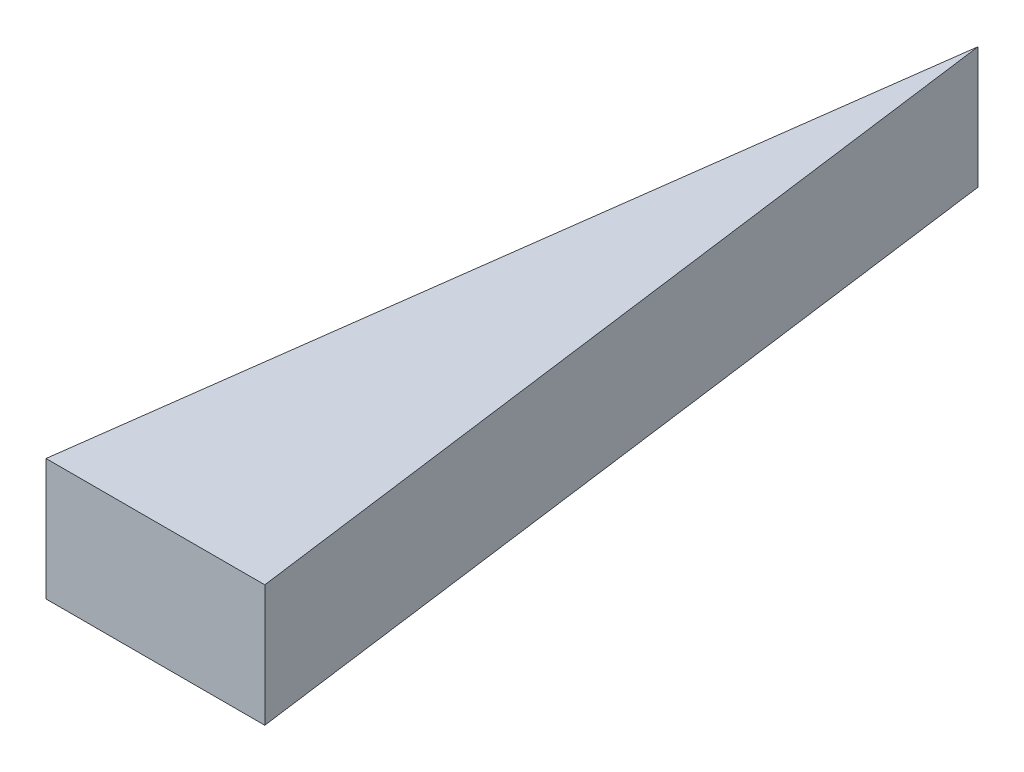
from build123d import *

# Parameters (mm, degrees)
MAIN_EXTRUDE_DEPTH = 65.09
SHELL1_T           = -5


with BuildPart() as part:
    # Sketch1 → Main extrude (new, symmetric)
    with BuildSketch(Plane(origin=(0, 0, 0), x_dir=(1, 0, 0), z_dir=(0, 1, 0))):
        Polygon((0, 0), (-117.055, -880.2309966), (117.055, -880.2309966), align=None)
    extrude(amount=MAIN_EXTRUDE_DEPTH, both=True)

    # Shell1
    shell1_openings = [part.faces().sort_by_distance(p)[0] for p in [
        (0, -65.09, 586.8206644),
    ]]
    offset(amount=SHELL1_T, openings=shell1_openings, kind=Kind.INTERSECTION)


solid = part.part
